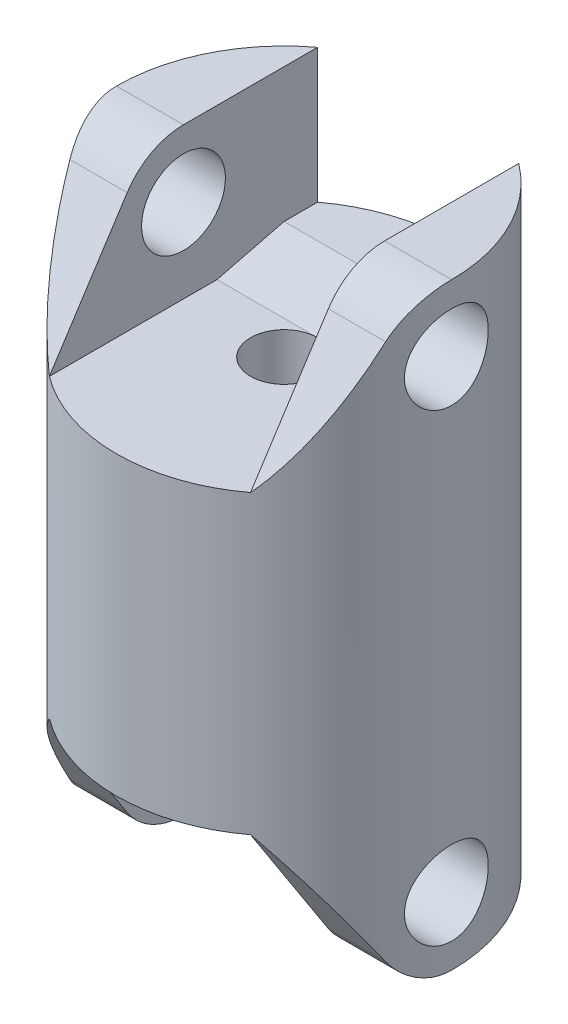
from build123d import *

# Parameters (mm, degrees)
SKETCH1_R               = 12.7
BOSS_EXTRUDE1_DEPTH     = 45.3136
CUT_EXTRUDE1_START      = -11.43
CUT_EXTRUDE1_DEPTH      = 11.43
CUT_EXTRUDE2_DEPTH      = 11.43
CUT_EXTRUDE3_DEPTH      = 52.259289353
CUT_EXTRUDE3_DEPTH_BACK = 52.259289353
SKETCH4_R               = 3.175
SKETCH5_R               = 2.54
CUT_EXTRUDE4_DEPTH      = 39.349424517
BOSS_EXTRUDE2_REACH     = 53.259
BOSS_EXTRUDE3_DEPTH     = 1.27


with BuildPart() as part:
    # Sketch1 → Boss-Extrude1 (new body)
    with BuildSketch(Plane(origin=(0, 0, 0), x_dir=(1, 0, 0), z_dir=(0, 1, 0))):
        with Locations(Location((0, 0, 0), (0, 0, 90))):
            Circle(SKETCH1_R)
    extrude(amount=BOSS_EXTRUDE1_DEPTH)

    # Sketch2 → Cut-Extrude1 (cut)
    with BuildSketch(Plane(origin=(0, 45.3136, 0), x_dir=(1, 0, 0), z_dir=(0, 1, 0)).offset(CUT_EXTRUDE1_START)):
        with BuildLine():
            Line((7.62, 10.16), (7.62, -10.16))
            ThreePointArc((7.62, -10.16), (0, -12.7), (-7.62, -10.16))
            Line((-7.62, -10.16), (-7.62, 10.16))
            ThreePointArc((-7.62, 10.16), (0, 12.7), (7.62, 10.16))
        make_face()
    extrude(amount=CUT_EXTRUDE1_DEPTH, mode=Mode.SUBTRACT)

    # Sketch3 → Cut-Extrude2 (cut)
    with BuildSketch(Plane.XZ):
        with BuildLine():
            Line((-7.62, 10.16), (-7.62, -10.16))
            ThreePointArc((-7.62, -10.16), (0, -12.7), (7.62, -10.16))
            Line((7.62, -10.16), (7.62, 10.16))
            ThreePointArc((7.62, 10.16), (0, 12.7), (-7.62, 10.16))
        make_face()
    extrude(amount=-CUT_EXTRUDE2_DEPTH, mode=Mode.SUBTRACT)

    # Sketch4 → Cut-Extrude3 (cut, two sides: drawn at the far end of the back side and taken through both)
    with BuildSketch(Plane(origin=(-7.62, 0, 0), x_dir=(0, 0, -1), z_dir=(1, 0, 0)).offset(-CUT_EXTRUDE3_DEPTH_BACK)):
        with Locations(Location((0, 40.2336, 0), (0, 0, 270))):
            Circle(SKETCH4_R)
        with Locations(Location((0, 5.08, 0), (0, 0, 270))):
            Circle(SKETCH4_R)
        with BuildLine():
            Line((0, 45.3136), (-10.16, 45.3136))
            Line((-10.16, 45.3136), (-10.16, 33.8836))
            Line((-10.16, 33.8836), (-4.264917923, 42.993468677))
            ThreePointArc((-4.264917923, 42.993468677), (-2.427577715, 44.696028312), (0, 45.3136))
        make_face()
        with BuildLine():
            Line((-10.16, 11.43), (-10.16, 0))
            Line((-10.16, 0), (0, 0))
            ThreePointArc((0, 0), (-2.427577715, 0.617571688), (-4.264917923, 2.320131323))
            Line((-4.264917923, 2.320131323), (-10.16, 11.43))
        make_face()
    extrude(amount=CUT_EXTRUDE3_DEPTH + CUT_EXTRUDE3_DEPTH_BACK, mode=Mode.SUBTRACT)

    # Sketch5 → Cut-Extrude4 (cut, through all)
    with BuildSketch(Plane(origin=(0, 33.8836, 0), x_dir=(1, 0, 0), z_dir=(0, 1, 0))):
        with Locations(Location((0, 0, 0), (0, 0, 270))):
            Circle(SKETCH5_R)
    extrude(amount=-CUT_EXTRUDE4_DEPTH, mode=Mode.SUBTRACT)

    # Boss-Extrude2: up to this face of the body (flat: up to its plane)
    boss_extrude2_end = Plane(part.part.faces().sort_by_distance((7.62, 34.116741009, 0))[0])
    # Sketch6 → Boss-Extrude2 (add, up to the picked face)
    with BuildSketch(Plane(origin=(-7.62, 0, 0), x_dir=(0, 0, -1), z_dir=(1, 0, 0)), mode=Mode.PRIVATE) as boss_extrude2_sk1:
        Polygon((2.54, 33.8836), (10.16, 33.8836), (10.16, 35.1536), (7.62, 35.1536), align=None)
    boss_extrude2_tool1 = split(extrude(boss_extrude2_sk1.sketch, amount=BOSS_EXTRUDE2_REACH, mode=Mode.PRIVATE), bisect_by=boss_extrude2_end, keep=Keep.BOTH, mode=Mode.PRIVATE)
    add(boss_extrude2_tool1.solids().sort_by(Axis((-7.62, 34.412767, -7.408333), (1, 0, 0)))[0])

    # Sketch7 → Boss-Extrude3 (add)
    with BuildSketch(Plane(origin=(0, 33.8836, 0), x_dir=(1, 0, 0), z_dir=(0, 1, 0))):
        with BuildLine():
            Line((-7.62, 10.16), (7.62, 10.16))
            ThreePointArc((7.62, 10.16), (0, 12.7), (-7.62, 10.16))
        make_face()
    extrude(amount=BOSS_EXTRUDE3_DEPTH)


solid = part.part
